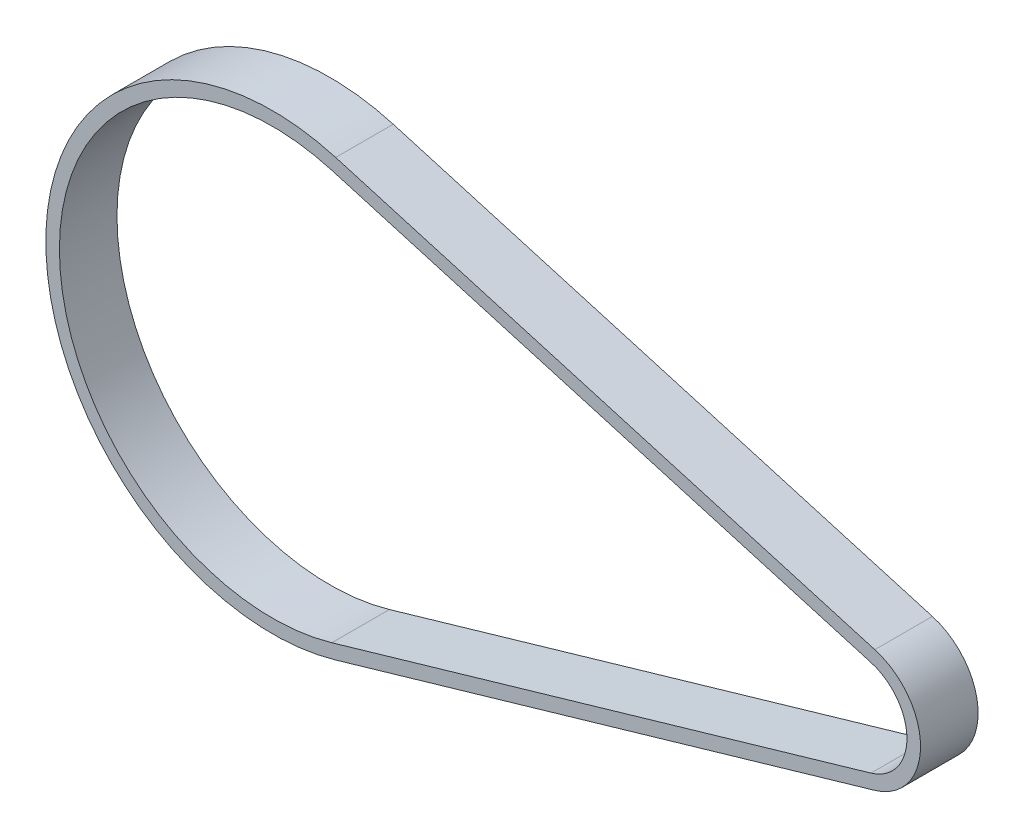
from build123d import *

# Parameters (mm, degrees)
BOSS_EXTRUDE1_DEPTH = 12.7


with BuildPart() as part:
    # Sketch1 → Boss-Extrude1 (new body)
    with BuildSketch(Plane.XY):
        with BuildLine():
            Line((-287.695279257, 107.838795968), (-168.741790885, 73.269046127))
            ThreePointArc((-168.741790885, 73.269046127), (-158.648767629, 59.825254522), (-168.741790885, 46.381462917))
            Line((-168.741790885, 46.381462917), (-287.695279257, 11.811713075))
            ThreePointArc((-287.695279257, 11.811713075), (-351.648767629, 59.825254522), (-287.695279257, 107.838795968))
        make_face()
        with BuildLine():
            Line((-288.532488559, 104.957983482), (-169.579000187, 70.38823364))
            ThreePointArc((-169.579000187, 70.38823364), (-161.648767629, 59.825254522), (-169.579000187, 49.262275403))
            Line((-169.579000187, 49.262275403), (-288.532488559, 14.692525562))
            ThreePointArc((-288.532488559, 14.692525562), (-348.648767629, 59.825254522), (-288.532488559, 104.957983482))
        make_face(mode=Mode.SUBTRACT)
    extrude(amount=BOSS_EXTRUDE1_DEPTH)


solid = part.part
